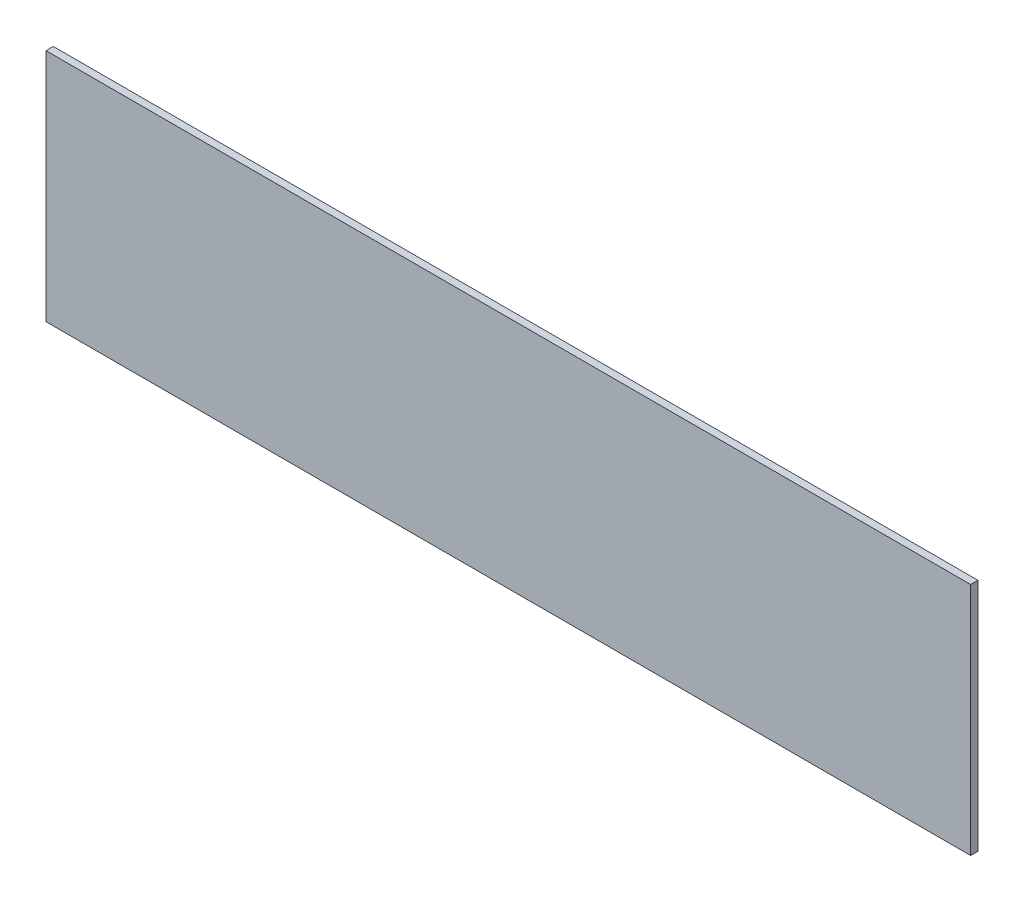
from build123d import *

# Parameters (mm, degrees)
SKETCH1_W           = 299.7
SKETCH1_H           = 76.075
BOSS_EXTRUDE1_DEPTH = 2.38125


with BuildPart() as part:
    # Sketch1 → Boss-Extrude1 (new body)
    with BuildSketch(Plane.XY):
        Rectangle(SKETCH1_W, SKETCH1_H)
    extrude(amount=BOSS_EXTRUDE1_DEPTH)


solid = part.part
